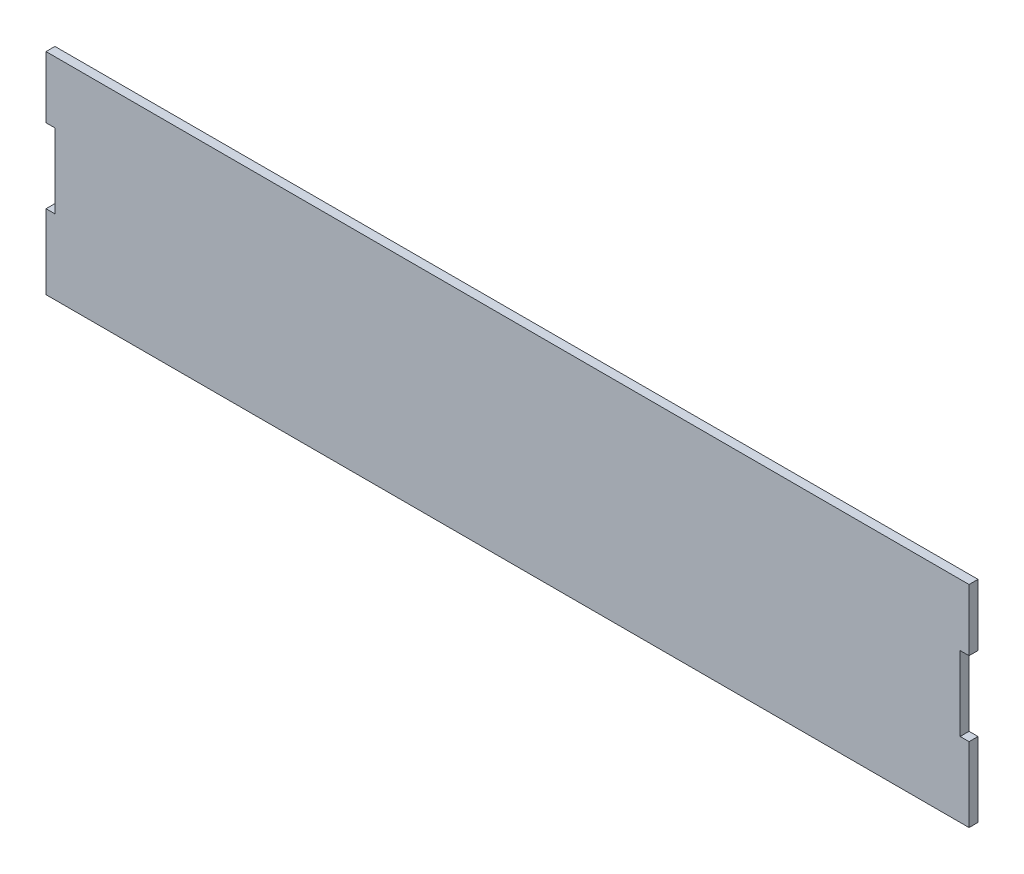
from build123d import *

# Parameters (mm, degrees)
EXTRUDE_1_DEPTH = 3


with BuildPart() as part:
    # 스케치1 → 보스-돌출1 (new body)
    with BuildSketch(Plane.XY):
        Polygon((-155, 35.355), (-155, 14.645), (-152, 14.645), (-152, -10.355), (-155, -10.355), (-155, -35.355), (155, -35.355), (155, -10.355), (152, -10.355), (152, 14.645), (155, 14.645), (155, 35.355), align=None)
    extrude(amount=EXTRUDE_1_DEPTH)


solid = part.part
